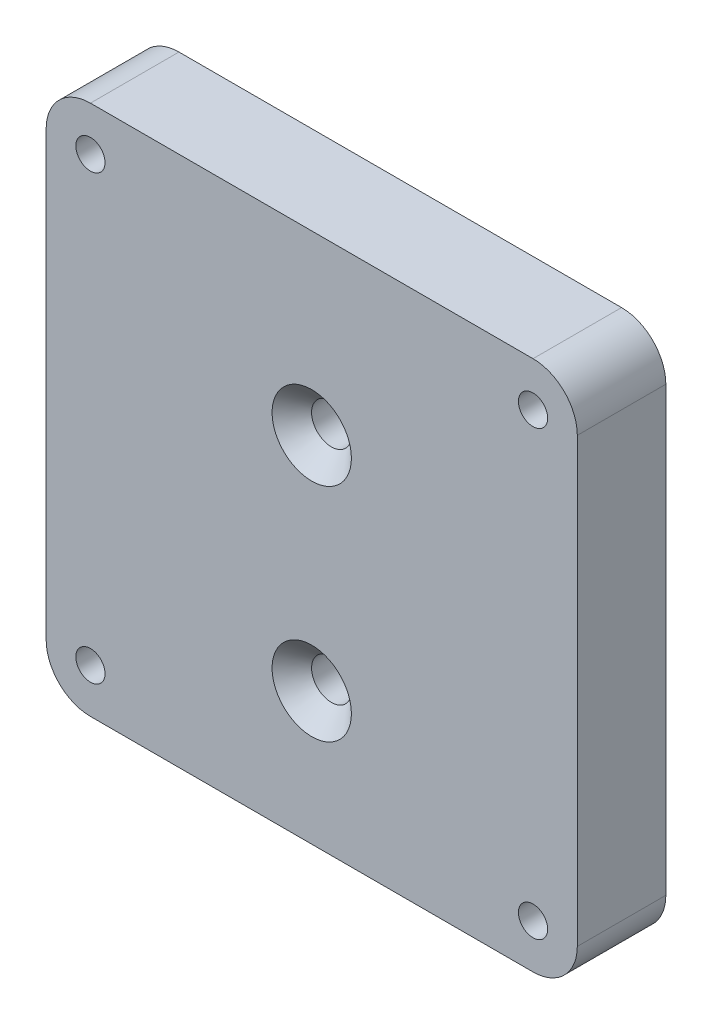
from build123d import *

# Parameters (mm, degrees)
SKETCH1_W                                            = 60
SKETCH1_H                                            = 60
BOSS_EXTRUDE1_DEPTH                                  = 10
M4_TAPPED_HOLE1_D                                    = 3.3
M4_TAPPED_HOLE1_DEPTH                                = 7.108579979
M4_TAPPED_HOLE1_TIP                                  = 0.991420021
CSK_FOR_M4_HEX_SOCKET_COUNTERSUNK_CAP_SC_D           = 4.5
CSK_FOR_M4_HEX_SOCKET_COUNTERSUNK_CAP_SC_CSINK_D     = 8.96
CSK_FOR_M4_HEX_SOCKET_COUNTERSUNK_CAP_SC_CSINK_ANGLE = 90
M4_TAPPED_HOLE2_D                                    = 3.3
M4_TAPPED_HOLE2_DEPTH                                = 8
M4_TAPPED_HOLE2_TIP                                  = 0.991420021
FILLET1_R                                            = 5


with BuildPart() as part:
    # Sketch1 → Boss-Extrude1 (new body)
    with BuildSketch(Plane.XY):
        with Locations((30, 30)):
            Rectangle(SKETCH1_W, SKETCH1_H)
    extrude(amount=BOSS_EXTRUDE1_DEPTH)

    # M4 Tapped Hole1
    with Locations(Plane.XY.offset(10)):
        with Locations((5, 55), (55, 55), (55, 5), (5, 5)):
            Hole(M4_TAPPED_HOLE1_D / 2, depth=M4_TAPPED_HOLE1_DEPTH)
            with Locations((0, 0, -(M4_TAPPED_HOLE1_DEPTH + M4_TAPPED_HOLE1_TIP / 2))):  # 118° drill point
                Cone(0, M4_TAPPED_HOLE1_D / 2, M4_TAPPED_HOLE1_TIP, mode=Mode.SUBTRACT)

    # CSK for M4 Hex Socket Countersunk Cap Screw1 (through all)
    with Locations(Plane.XY.offset(10)):
        with Locations((30, 40), (30, 15)):
            CounterSinkHole(CSK_FOR_M4_HEX_SOCKET_COUNTERSUNK_CAP_SC_D / 2, CSK_FOR_M4_HEX_SOCKET_COUNTERSUNK_CAP_SC_CSINK_D / 2, counter_sink_angle=CSK_FOR_M4_HEX_SOCKET_COUNTERSUNK_CAP_SC_CSINK_ANGLE)

    # M4 Tapped Hole2
    with Locations(Plane(origin=(0, 0, 0), x_dir=(-1, 0, 0), z_dir=(0, -1, 0))):
        with Locations((-30, -5), (-14, -5), (-46, -5)):
            Hole(M4_TAPPED_HOLE2_D / 2, depth=M4_TAPPED_HOLE2_DEPTH)
            with Locations((0, 0, -(M4_TAPPED_HOLE2_DEPTH + M4_TAPPED_HOLE2_TIP / 2))):  # 118° drill point
                Cone(0, M4_TAPPED_HOLE2_D / 2, M4_TAPPED_HOLE2_TIP, mode=Mode.SUBTRACT)

    # Fillet1
    fillet1_edges = [part.edges().sort_by_distance(p)[0] for p in [
        (0, 60, 5),
        (60, 60, 5),
        (60, 0, 5),
        (0, 0, 5),
    ]]
    fillet(fillet1_edges, radius=FILLET1_R)


solid = part.part
